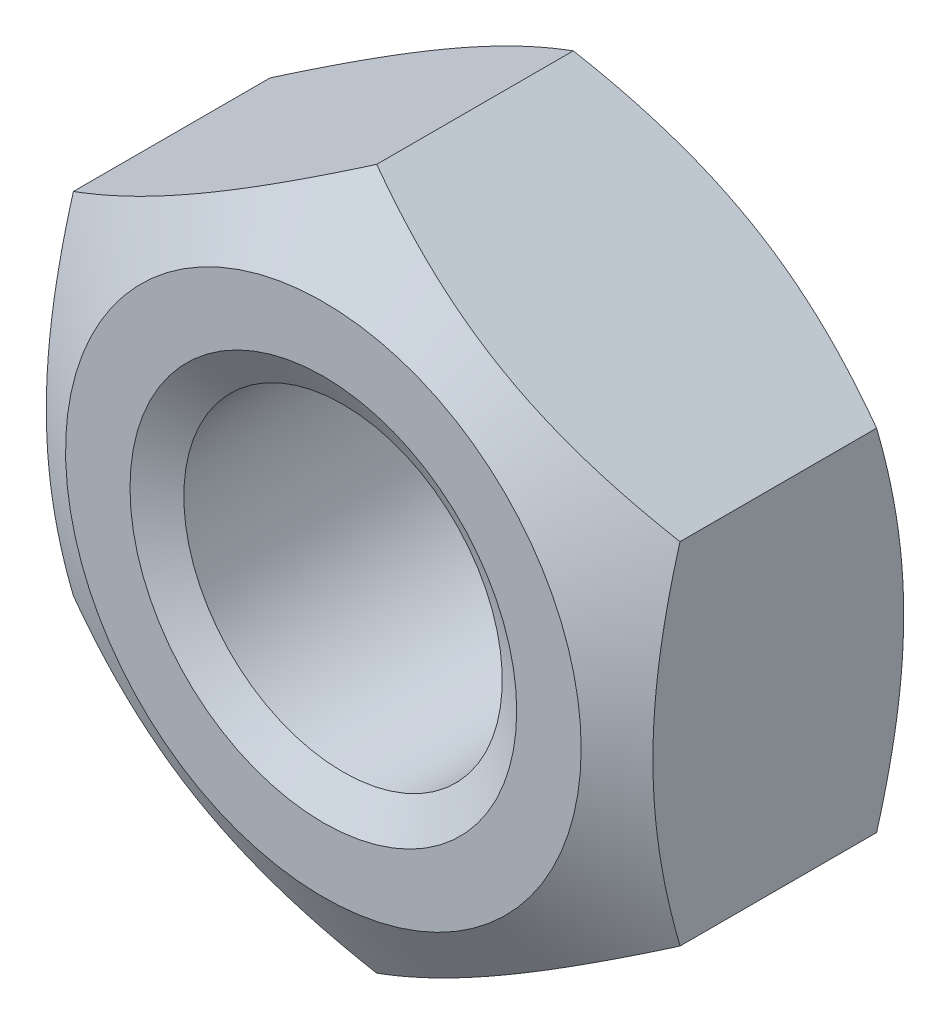
from build123d import *

# Parameters (mm, degrees)
BOSS_EXTRUDE1_DEPTH = 4


with BuildPart() as part:
    # Sketch1 → Boss-Extrude1 (new body)
    with BuildSketch(Plane.XY):
        Polygon((0, 4.618802154), (-4, 2.309401077), (-4, -2.309401077), (0, -4.618802154), (4, -2.309401077), (4, 2.309401077), align=None)
    extrude(amount=-BOSS_EXTRUDE1_DEPTH)

    # Sketch4 → Cut-Revolve1 (revolve, cut)
    with BuildSketch(Plane(origin=(0, 0, 0), x_dir=(0, 0, -1), z_dir=(1, 0, 0)), mode=Mode.PRIVATE) as cut_revolve1_sk:
        Polygon((4, 4.618802154), (3.296324249, 4.618802154), (4, 3.4), align=None)
        Polygon((0, 4.618802154), (0.703675751, 4.618802154), (0, 3.4), align=None)
    revolve(cut_revolve1_sk.sketch.rotate(Axis((0, 0, 0), (0, 0, -1)), 299.999999945), axis=Axis((0, 0, 0), (0, 0, -1)), mode=Mode.SUBTRACT)

    # Sketch5 → Cut-Revolve2 (revolve, cut)
    with BuildSketch(Plane(origin=(0, 0, 0), x_dir=(0, 0, -1), z_dir=(1, 0, 0)), mode=Mode.PRIVATE) as cut_revolve2_sk:
        Polygon((0, 0), (0, 2.55), (0.259807621, 2.1), (3.740192379, 2.1), (4, 2.55), (4, 0), align=None)
    revolve(cut_revolve2_sk.sketch.rotate(Axis((0, 0, 0), (0, 0, -1)), 180), axis=Axis((0, 0, 0), (0, 0, -1)), mode=Mode.SUBTRACT)


solid = part.part
